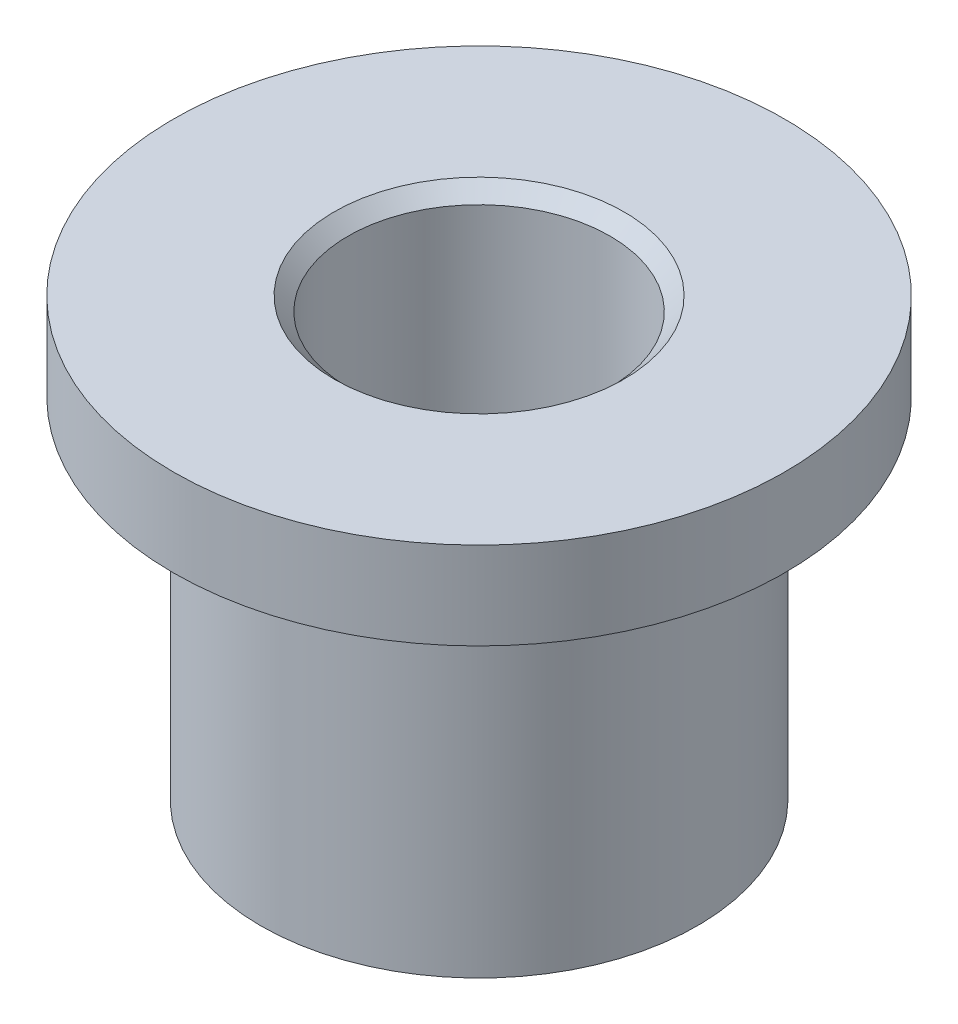
from build123d import *

# Parameters (mm, degrees)
CHAMFER1_SIZE = 0.254


with BuildPart() as part:
    # Sketch1 → Revolve1 (revolve)
    with BuildSketch(Plane.XY, mode=Mode.PRIVATE) as revolve1_sk:
        Polygon((-2.38125, 3.96875), (-5.55625, 3.96875), (-5.55625, 2.38125), (-3.96875, 2.38125), (-3.96875, -3.96875), (-2.38125, -3.96875), align=None)
    revolve(revolve1_sk.sketch.rotate(Axis((0, 6.35, 0), (0, -1, 0)), 270), axis=Axis((0, 6.35, 0), (0, -1, 0)))

    # Chamfer1
    chamfer1_edges = [part.edges().sort_by_distance(p)[0] for p in [
        (0, -3.96875, -2.38125),
        (0, 3.96875, -2.38125),
    ]]
    chamfer(chamfer1_edges, length=CHAMFER1_SIZE)


solid = part.part
